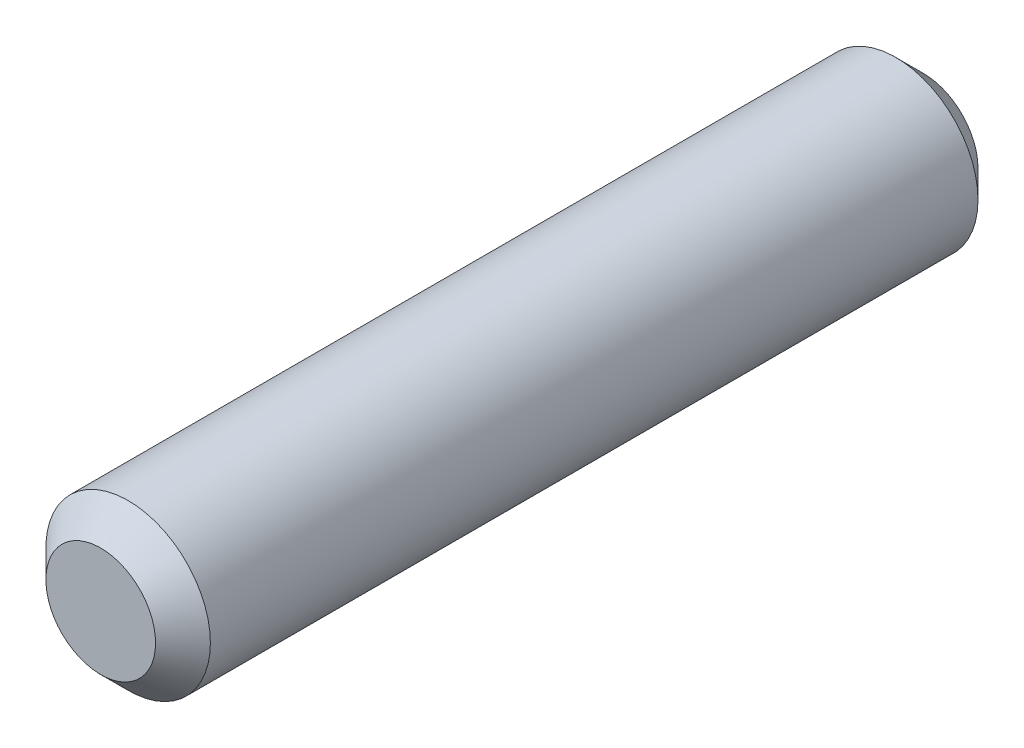
from build123d import *

# Parameters (mm, degrees)
SKETCH_1_R      = 1.5
EXTRUDE_1_DEPTH = 15
CHAMFER_1_SIZE  = 0.5


with BuildPart() as part:
    # Эскиз1 → Бобышка-Вытянуть1 (new body)
    with BuildSketch(Plane.XY):
        Circle(SKETCH_1_R)
    extrude(amount=EXTRUDE_1_DEPTH)

    # Фаска1
    chamfer_1_edges = [part.edges().sort_by_distance(p)[0] for p in [
        (-1.5, 0, 0),
        (-1.5, 0, 15),
    ]]
    chamfer(chamfer_1_edges, length=CHAMFER_1_SIZE)


solid = part.part
